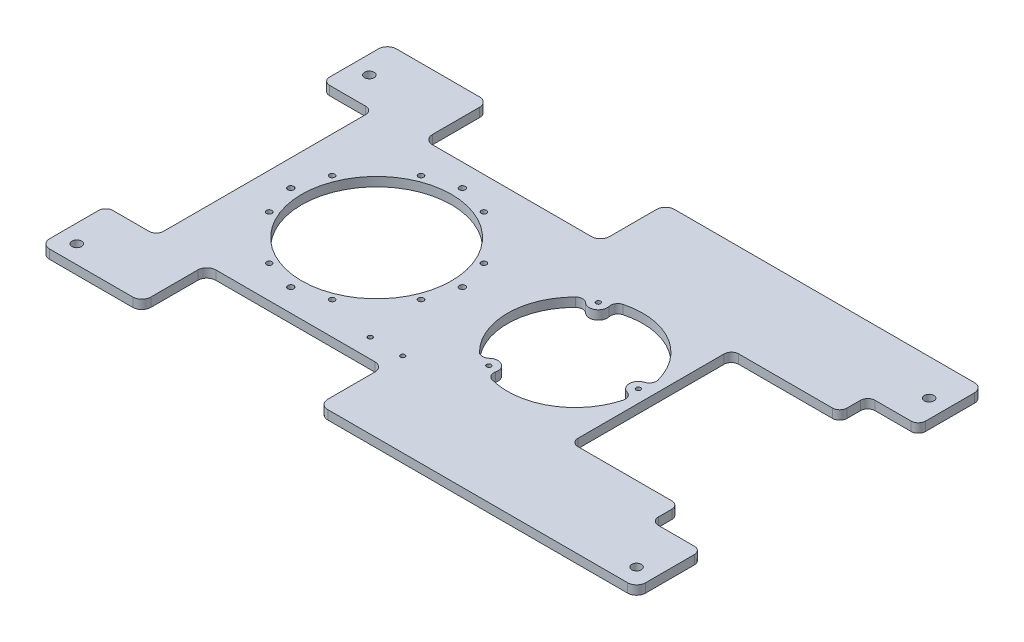
from build123d import *

# Parameters (mm, degrees)
SKETCH1_W                = 330
SKETCH1_H                = 192
BOSS_EXTRUDE1_DEPTH      = 5
CUT_EXTRUDE1_DEPTH       = 382.823257542
CUT_EXTRUDE1_DEPTH_BACK  = 382.823257542
SKETCH2_R                = 1.5
SKETCH3_R                = 41.5
CUT_EXTRUDE2_DEPTH       = 382.823257542
M5_CLEARANCE_HOLE1_D     = 5.3
M5_CLEARANCE_HOLE1_DEPTH = 11.94
M5_CLEARANCE_HOLE1_TIP   = 1.59228064
TAP_DRILL_FOR_M4_TAP1_D  = 3.3
CUT_EXTRUDE3_DEPTH       = 382.823257542
CUT_EXTRUDE3_DEPTH_BACK  = 382.823257542
SKETCH19_W               = 28
SKETCH19_H               = 120
SKETCH21_W               = 60
SKETCH21_H               = 89
CUT_EXTRUDE4_DEPTH       = 382.823257542
FILLET1_R                = 4
TAP_DRILL_FOR_M3_TAP1_D  = 2.5
TAP_DRILL_FOR_M3_TAP2_D  = 2.5
CUT_EXTRUDE5_DEPTH       = 382.823257542
FILLET2_R                = 4
SKETCH33_W               = 98
SKETCH33_H               = 36
CUT_EXTRUDE6_DEPTH       = 382.82325768
FILLET3_R                = 5


with BuildPart() as part:
    # Sketch1 → Boss-Extrude1 (new body)
    with BuildSketch(Plane(origin=(0, 0, 0), x_dir=(1, 0, 0), z_dir=(0, 1, 0))):
        with Locations((165, 96)):
            Rectangle(SKETCH1_W, SKETCH1_H)
    extrude(amount=BOSS_EXTRUDE1_DEPTH)

    # Sketch2 → Cut-Extrude1 (cut, two sides: drawn at the far end of the back side and taken through both)
    with BuildSketch(Plane(origin=(0, 5, 0), x_dir=(1, 0, 0), z_dir=(0, 1, 0)).offset(-CUT_EXTRUDE1_DEPTH_BACK)):
        with Locations(Location((132.036518729, 113.412096173, 0), (0, 0, 270))):
            Circle(SKETCH2_R)
        with Locations(Location((132.036518729, 78.587903827, 0), (0, 0, 270))):
            Circle(SKETCH2_R)
        with Locations(Location((107.412096173, 53.963481271, 0), (0, 0, 270))):
            Circle(SKETCH2_R)
        with Locations(Location((72.587903827, 53.963481271, 0), (0, 0, 270))):
            Circle(SKETCH2_R)
        with Locations(Location((47.963481271, 78.587903827, 0), (0, 0, 270))):
            Circle(SKETCH2_R)
        with Locations(Location((47.963481271, 113.412096173, 0), (0, 0, 270))):
            Circle(SKETCH2_R)
        with Locations(Location((72.587903827, 138.036518729, 0), (0, 0, 270))):
            Circle(SKETCH2_R)
        with Locations(Location((107.412096173, 138.036518729, 0), (0, 0, 270))):
            Circle(SKETCH2_R)
    extrude(amount=CUT_EXTRUDE1_DEPTH + CUT_EXTRUDE1_DEPTH_BACK, mode=Mode.SUBTRACT)

    # Sketch3 → Cut-Extrude2 (cut, through all)
    with BuildSketch(Plane(origin=(0, 5, 0), x_dir=(1, 0, 0), z_dir=(0, 1, 0))):
        with Locations(Location((90, 96, 0), (0, 0, 270))):
            Circle(SKETCH3_R)
    extrude(amount=-CUT_EXTRUDE2_DEPTH, mode=Mode.SUBTRACT)

    # M5 Clearance Hole1
    with Locations(Plane(origin=(0, 5, 0), x_dir=(1, 0, 0), z_dir=(0, 1, 0))):
        with Locations((10, 172), (10, 10), (320, 10), (320, 172)):
            Hole(M5_CLEARANCE_HOLE1_D / 2, depth=M5_CLEARANCE_HOLE1_DEPTH)
            with Locations((0, 0, -(M5_CLEARANCE_HOLE1_DEPTH + M5_CLEARANCE_HOLE1_TIP / 2))):  # 118° drill point
                Cone(0, M5_CLEARANCE_HOLE1_D / 2, M5_CLEARANCE_HOLE1_TIP, mode=Mode.SUBTRACT)

    # Tap Drill for M4 Tap1 (through all)
    with Locations(Plane(origin=(0, 5, 0), x_dir=(1, 0, 0), z_dir=(0, 1, 0))):
        with Locations((137.5, 96), (90, 48.5), (42.5, 96), (90, 143.5)):
            Hole(TAP_DRILL_FOR_M4_TAP1_D / 2)

    # Sketch19 → Cut-Extrude3 (cut, two sides: drawn at the far end of the back side and taken through both)
    with BuildSketch(Plane(origin=(0, 5, 0), x_dir=(1, 0, 0), z_dir=(0, 1, 0)).offset(-CUT_EXTRUDE3_DEPTH_BACK)):
        with Locations((14, 96)):
            Rectangle(SKETCH19_W, SKETCH19_H)
        with Locations((316, 96)):
            Rectangle(SKETCH19_W, SKETCH19_H)
    extrude(amount=CUT_EXTRUDE3_DEPTH + CUT_EXTRUDE3_DEPTH_BACK, mode=Mode.SUBTRACT)

    # Sketch21 → Cut-Extrude4 (cut, through all)
    with BuildSketch(Plane.XZ):
        with Locations((272, -96)):
            Rectangle(SKETCH21_W, SKETCH21_H)
    extrude(amount=-CUT_EXTRUDE4_DEPTH, mode=Mode.SUBTRACT)

    # Fillet1
    fillet1_edges = [part.edges().sort_by_distance(p)[0] for p in [
        (0, 2.5, -36),
        (0, 2.5, -156),
        (28, 2.5, -156),
        (28, 2.5, -36),
        (330, 2.5, -156),
        (330, 2.5, -36),
        (302, 2.5, -36),
        (302, 2.5, -156),
        (302, 2.5, -51.5),
        (302, 2.5, -140.5),
        (242, 2.5, -140.5),
        (242, 2.5, -51.5),
    ]]
    fillet(fillet1_edges, radius=FILLET1_R)

    # Tap Drill for M3 Tap1 (through all)
    with Locations(Plane(origin=(0, 0, 0), x_dir=(-1, 0, 0), z_dir=(0, -1, 0))):
        with Locations((-182.5, 126.310889132), (-182.5, 65.689110868), (-235, 96)):
            Hole(TAP_DRILL_FOR_M3_TAP1_D / 2)

    # Tap Drill for M3 Tap2 (through all)
    with Locations(Plane(origin=(0, 0, 0), x_dir=(-1, 0, 0), z_dir=(0, -1, 0))):
        with Locations((-154, 46.5), (-136, 46.5)):
            Hole(TAP_DRILL_FOR_M3_TAP2_D / 2)

    # Sketch32 → Cut-Extrude5 (cut, through all)
    with BuildSketch(Plane.XZ):
        with BuildLine():
            ThreePointArc((237.232142857, -100.474096363), (230, -96), (237.232142857, -91.525903637))
            ThreePointArc((237.232142857, -91.525903637), (218.75, -63.524047358), (185.258609681, -61.518970267))
            ThreePointArc((185.258609681, -61.518970267), (186.904148522, -63.321944672), (187.5, -65.689110868))
            ThreePointArc((187.5, -65.689110868), (182.6520482, -70.686798467), (177.509247462, -65.99306663))
            ThreePointArc((177.509247462, -65.99306663), (162.5, -96), (177.509247462, -126.00693337))
            ThreePointArc((177.509247462, -126.00693337), (182.6520482, -121.313201533), (187.5, -126.310889132))
            ThreePointArc((187.5, -126.310889132), (186.904148522, -128.678055328), (185.258609681, -130.481029733))
            ThreePointArc((185.258609681, -130.481029733), (218.75, -128.475952642), (237.232142857, -100.474096363))
        make_face()
    extrude(amount=-CUT_EXTRUDE5_DEPTH, mode=Mode.SUBTRACT)

    # Fillet2
    fillet2_edges = [part.edges().sort_by_distance(p)[0] for p in [
        (237.232142857, 2.5, -91.525903637),
        (237.232142857, 2.5, -100.474096363),
        (185.258609681, 2.5, -130.481029733),
        (177.509247462, 2.5, -126.00693337),
        (177.509247462, 2.5, -65.99306663),
        (185.258609681, 2.5, -61.518970267),
    ]]
    fillet(fillet2_edges, radius=FILLET2_R)

    # Sketch33 → Cut-Extrude6 (cut, through all)
    with BuildSketch(Plane.XZ):
        with Locations((105, -18)):
            Rectangle(SKETCH33_W, SKETCH33_H)
        with Locations((105, -174)):
            Rectangle(SKETCH33_W, SKETCH33_H)
    extrude(amount=-CUT_EXTRUDE6_DEPTH, mode=Mode.SUBTRACT)

    # Fillet3
    fillet3_edges = [part.edges().sort_by_distance(p)[0] for p in [
        (56, 2.5, -36),
        (56, 2.5, 0),
        (154, 2.5, 0),
        (154, 2.5, -36),
        (56, 2.5, -192),
        (56, 2.5, -156),
        (154, 2.5, -156),
        (154, 2.5, -192),
        (0, 2.5, -192),
        (330, 2.5, -192),
        (330, 2.5, 0),
        (0, 2.5, 0),
    ]]
    fillet(fillet3_edges, radius=FILLET3_R)


solid = part.part
